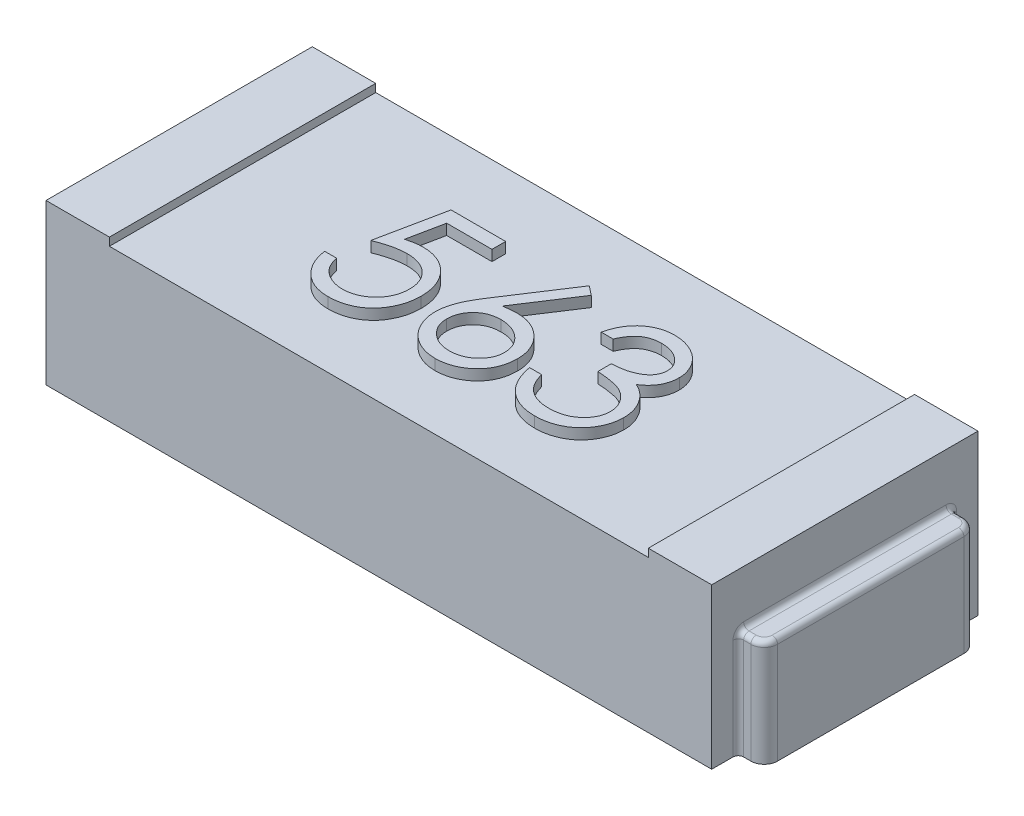
from build123d import *

# Parameters (mm, degrees)
ESQUISSE1_W             = 2.5
ESQUISSE1_H             = 1
BOSS_EXTRU_1_DEPTH      = 0.6
ESQUISSE2_W             = 2.023603034
ESQUISSE2_H             = 1
ENL_V_MAT_EXTRU_1_DEPTH = 0.03
BOSS_EXTRU_2_DEPTH      = 0.4
CONG_1_R                = 0.02
CONG_1_OF_SYM_TRIE2_R   = 0.02
BOSS_EXTRU_3_DEPTH      = 0.04


with BuildPart() as part:
    # Esquisse1 → Boss.-Extru.1 (new body)
    with BuildSketch(Plane(origin=(0, 0, 0), x_dir=(1, 0, 0), z_dir=(0, 1, 0))):
        Rectangle(ESQUISSE1_W, ESQUISSE1_H)
    extrude(amount=BOSS_EXTRU_1_DEPTH)

    # Esquisse2 → Enlèv. mat.-Extru.1 (cut)
    with BuildSketch(Plane(origin=(0, 0.6, 0), x_dir=(1, 0, 0), z_dir=(0, 1, 0))):
        Rectangle(ESQUISSE2_W, ESQUISSE2_H)
    extrude(amount=-ENL_V_MAT_EXTRU_1_DEPTH, mode=Mode.SUBTRACT)

    # Esquisse3 → Boss.-Extru.2 (add)
    with BuildSketch(Plane(origin=(0, 0, 0), x_dir=(1, 0, 0), z_dir=(0, 1, 0))):
        with BuildLine():
            Line((1.25, 0.4), (1.297141448, 0.4))
            ThreePointArc((1.297141448, 0.4), (1.332496787, 0.385355339), (1.347141448, 0.35))
            Line((1.347141448, 0.35), (1.347141448, -0.35))
            ThreePointArc((1.347141448, -0.35), (1.332496787, -0.385355339), (1.297141448, -0.4))
            Line((1.297141448, -0.4), (1.25, -0.4))
            Line((1.25, -0.4), (1.25, 0.4))
        make_face()
    boss_extru_2 = extrude(amount=BOSS_EXTRU_2_DEPTH)

    # Congé1
    cong_1_edges = [part.edges().sort_by_distance(p)[0] for p in [
        (1.25, 0.2, -0.4),
        (1.25, 0.2, 0.4),
        (1.25, 0.4, 0),
        (1.273570724, 0.4, 0.4),
        (1.332496787, 0.4, 0.385355339),
        (1.347141448, 0.4, 0),
        (1.332496787, 0.4, -0.385355339),
        (1.273570724, 0.4, -0.4),
    ]]
    fillet(cong_1_edges, radius=CONG_1_R)

    # Symétrie2: Boss.-Extru.2 across plane
    add(boss_extru_2.mirror(Plane(origin=(0, 0, 0), x_dir=(0, 0, 1), z_dir=(1, 0, 0))))

    # Congé1 of Symétrie2
    cong_1_of_sym_trie2_edges = [part.edges().sort_by_distance(p)[0] for p in [
        (-1.25, 0.2, -0.4),
        (-1.25, 0.2, 0.4),
        (-1.25, 0.4, 0),
        (-1.273570724, 0.4, 0.4),
        (-1.332496787, 0.4, 0.385355339),
        (-1.347141448, 0.4, 0),
        (-1.332496787, 0.4, -0.385355339),
        (-1.273570724, 0.4, -0.4),
    ]]
    fillet(cong_1_of_sym_trie2_edges, radius=CONG_1_OF_SYM_TRIE2_R)

    # Esquisse4 → Boss.-Extru.3 (add)
    # profile 1 of 3: a face of its own
    with BuildSketch(Plane(origin=(0, 0.57, 0), x_dir=(1, 0, 0), z_dir=(0, 1, 0))):
        with BuildLine():
            Line((0.275641026, 0.104315862), (0.230769231, 0.104315862))
            add(Edge.make_bspline(
                [(0.230769231, 0.104315862), (0.231984881, 0.109349074), (0.234361377, 0.119188592), (0.239318174, 0.133246772), (0.244718067, 0.146550132), (0.251202225, 0.158849571), (0.258274904, 0.170392272), (0.26637815, 0.180916432), (0.27513811, 0.190689713), (0.284827389, 0.199363033), (0.294988626, 0.207216994), (0.305765001, 0.213913431), (0.3169397, 0.219674024), (0.328590147, 0.224419771), (0.340751029, 0.227994846), (0.353312404, 0.230588676), (0.366307189, 0.23227312), (0.375128274, 0.232437515), (0.379607372, 0.23252099)],
                knots=[0, 0, 0, 0, 1.162005537, 2.271625781, 3.343758855, 4.383309926, 5.390229558, 6.379919256, 7.361854164, 8.333198761, 9.295911338, 10.242430842, 11.177959212, 12.116337295, 13.062827104, 14.020064771, 14.994644689, 16, 16, 16, 16], degree=3))
            add(Edge.make_bspline(
                [(0.379607372, 0.23252099), (0.386133478, 0.232323957), (0.399043337, 0.231934189), (0.418009486, 0.228374984), (0.436299032, 0.222742822), (0.453711781, 0.214960861), (0.469885843, 0.205362674), (0.484276727, 0.19393914), (0.496689371, 0.180910668), (0.507102854, 0.166520302), (0.515256425, 0.151140943), (0.521268764, 0.13531235), (0.524929004, 0.119072068), (0.52540337, 0.108106742), (0.525641026, 0.102613138)],
                knots=[0, 0, 0, 0, 1.083050992, 2.142477498, 3.193116406, 4.255571735, 5.30263384, 6.308962982, 7.297363603, 8.282367274, 9.249857812, 10.179914175, 11.08814088, 12, 12, 12, 12], degree=3))
            add(Edge.make_bspline(
                [(0.525641026, 0.102613138), (0.525474798, 0.097326453), (0.525149517, 0.086981231), (0.522387559, 0.07187816), (0.517739522, 0.057643645), (0.511300984, 0.044217765), (0.502966477, 0.031685645), (0.492870378, 0.020019089), (0.480941426, 0.009166352), (0.471901578, 0.002949285), (0.467247596, -0.000251446)],
                knots=[0, 0, 0, 0, 1.024540389, 2.004866551, 2.965041327, 3.920577974, 4.882998113, 5.874504559, 6.905732034, 8, 8, 8, 8], degree=3))
            add(Edge.make_bspline(
                [(0.467247596, -0.000251446), (0.472566418, -0.002819756), (0.483104543, -0.007908321), (0.497468904, -0.017887715), (0.510508601, -0.029410051), (0.517780561, -0.038401858), (0.521434295, -0.042919715)],
                knots=[0, 0, 0, 0, 1.015518401, 2.012035669, 3.001164323, 4, 4, 4, 4], degree=3))
            add(Edge.make_bspline(
                [(0.521434295, -0.042919715), (0.523840201, -0.046213679), (0.528612615, -0.052747668), (0.534503405, -0.063252871), (0.539847564, -0.073874513), (0.544011881, -0.084897285), (0.54723672, -0.09619343), (0.549541867, -0.107782343), (0.550973887, -0.119673489), (0.551178966, -0.127718129), (0.551282051, -0.131761862)],
                knots=[0, 0, 0, 0, 1.025084078, 2.033381695, 3.024893161, 4.013698104, 4.991890475, 5.976764909, 6.982997093, 8, 8, 8, 8], degree=3))
            add(Edge.make_bspline(
                [(0.551282051, -0.131761862), (0.551025692, -0.138763251), (0.55051418, -0.15273308), (0.54594217, -0.173372326), (0.538854564, -0.193547398), (0.528789287, -0.212843803), (0.516522501, -0.230898143), (0.501928597, -0.247051902), (0.485173396, -0.260937417), (0.466486875, -0.272538878), (0.446241571, -0.281812867), (0.424587915, -0.288249644), (0.401837907, -0.29244193), (0.386236864, -0.292891483), (0.378305288, -0.293120035)],
                knots=[0, 0, 0, 0, 0.955779014, 1.907060117, 2.875433937, 3.871313158, 4.872415639, 5.851225146, 6.836215519, 7.83643374, 8.849228613, 9.86973379, 10.916971861, 12, 12, 12, 12], degree=3))
            add(Edge.make_bspline(
                [(0.378305288, -0.293120035), (0.372959674, -0.292996005), (0.362441288, -0.292751954), (0.346977931, -0.291083583), (0.332217688, -0.288036439), (0.318140603, -0.283935967), (0.304734169, -0.278737147), (0.292039297, -0.272263047), (0.279977883, -0.264647118), (0.268663747, -0.255799463), (0.258098238, -0.245902128), (0.248562134, -0.234779413), (0.23989645, -0.222636926), (0.232333215, -0.209333633), (0.225527937, -0.195041453), (0.219930657, -0.179577382), (0.215004147, -0.163079664), (0.212713652, -0.151582844), (0.211538462, -0.145684138)],
                knots=[0, 0, 0, 0, 1.048658725, 2.063410685, 3.046034179, 4.001477787, 4.936774919, 5.862367409, 6.792675028, 7.730719943, 8.675894397, 9.627829632, 10.600096036, 11.597688215, 12.626045268, 13.701542398, 14.82072376, 16, 16, 16, 16], degree=3))
            Line((0.211538462, -0.145684138), (0.256410256, -0.145684138))
            add(Edge.make_bspline(
                [(0.256410256, -0.145684138), (0.257579298, -0.149533997), (0.259853186, -0.157022307), (0.2637238, -0.167799494), (0.268133553, -0.177679216), (0.272864204, -0.186733947), (0.277832553, -0.195052862), (0.283391828, -0.202415986), (0.289130278, -0.209146729), (0.2934559, -0.212938817), (0.295572917, -0.214794715)],
                knots=[0, 0, 0, 0, 1.198163088, 2.33053128, 3.407730985, 4.417276592, 5.372219308, 6.28897303, 7.162600585, 8, 8, 8, 8], degree=3))
            add(Edge.make_bspline(
                [(0.295572917, -0.214794715), (0.298372428, -0.216953048), (0.303962808, -0.221263053), (0.313072555, -0.226763286), (0.322653253, -0.231529146), (0.332912492, -0.235169674), (0.343628888, -0.238252197), (0.354975655, -0.240269414), (0.366852686, -0.241653439), (0.374962366, -0.241775572), (0.379106571, -0.241837984)],
                knots=[0, 0, 0, 0, 0.946170439, 1.889420265, 2.845303464, 3.807233317, 4.801018734, 5.828864929, 6.890507805, 8, 8, 8, 8], degree=3))
            add(Edge.make_bspline(
                [(0.379106571, -0.241837984), (0.383785642, -0.241749998), (0.392935163, -0.241577948), (0.406285857, -0.239995704), (0.418986921, -0.237691359), (0.430897339, -0.234132362), (0.442173126, -0.229735097), (0.452656219, -0.224213896), (0.462484234, -0.217736079), (0.471531292, -0.210373342), (0.479666365, -0.202313128), (0.486829152, -0.19388269), (0.49291839, -0.185117571), (0.497830329, -0.175969268), (0.501708979, -0.166475664), (0.504349437, -0.156610117), (0.506185367, -0.146453365), (0.506334883, -0.139549226), (0.506410256, -0.136068753)],
                knots=[0, 0, 0, 0, 1.217147791, 2.380027433, 3.494444702, 4.572153297, 5.609568379, 6.639424714, 7.649109417, 8.668170816, 9.669597737, 10.625200337, 11.543417969, 12.441394052, 13.322311151, 14.205496177, 15.095365482, 16, 16, 16, 16], degree=3))
            add(Edge.make_bspline(
                [(0.506410256, -0.136068753), (0.506191642, -0.131409991), (0.505755501, -0.122115647), (0.502425704, -0.108441707), (0.496948723, -0.095266934), (0.489281221, -0.082816107), (0.479947546, -0.071276693), (0.469038273, -0.060980767), (0.456462812, -0.052485039), (0.444888545, -0.046615231), (0.43463638, -0.042609935), (0.425862754, -0.039942083), (0.416040382, -0.037682989), (0.405288046, -0.035581236), (0.39352473, -0.033792472), (0.380763238, -0.032300784), (0.367000987, -0.031107207), (0.357473677, -0.030574193), (0.352564103, -0.030299523)],
                knots=[0, 0, 0, 0, 1.07054697, 2.135767047, 3.216561865, 4.33974944, 5.486079747, 6.621378074, 7.775625952, 8.963672916, 9.598146892, 10.304877434, 11.070270905, 11.915000392, 12.823868403, 13.805723172, 14.86925407, 16, 16, 16, 16], degree=3))
            Line((0.352564103, -0.030299523), (0.352564103, 0.020982529))
            add(Edge.make_bspline(
                [(0.352564103, 0.020982529), (0.358749983, 0.021087501), (0.370866604, 0.021293115), (0.388565791, 0.023779974), (0.40549055, 0.027220063), (0.421265798, 0.032489376), (0.435644186, 0.038609419), (0.448118415, 0.045731163), (0.458513722, 0.053647556), (0.466779589, 0.062480786), (0.47299805, 0.071954364), (0.477544736, 0.081828172), (0.480230497, 0.092188752), (0.48058902, 0.099259419), (0.480769231, 0.102813458)],
                knots=[0, 0, 0, 0, 1.321986639, 2.589447074, 3.816329219, 5.01088745, 6.139805852, 7.153945165, 8.075214402, 8.924034688, 9.728124013, 10.488707548, 11.240355623, 12, 12, 12, 12], degree=3))
            add(Edge.make_bspline(
                [(0.480769231, 0.102813458), (0.480710029, 0.105424565), (0.48059225, 0.110619237), (0.479106925, 0.118208533), (0.476874919, 0.125565811), (0.473806386, 0.132659783), (0.469699215, 0.139441251), (0.464784074, 0.14596803), (0.458931489, 0.152202855), (0.452224996, 0.158014329), (0.44502331, 0.163552792), (0.437130485, 0.16825474), (0.428784503, 0.172275463), (0.419976123, 0.175591106), (0.410676762, 0.17808529), (0.400930111, 0.179876125), (0.390717585, 0.18099579), (0.383750194, 0.181156992), (0.380208333, 0.181238939)],
                knots=[0, 0, 0, 0, 0.884392785, 1.759457502, 2.611959086, 3.489218968, 4.37281399, 5.2945488, 6.255912374, 7.266815255, 8.301784654, 9.332968512, 10.37626691, 11.440494194, 12.520033166, 13.637162961, 14.798855837, 16, 16, 16, 16], degree=3))
            add(Edge.make_bspline(
                [(0.380208333, 0.181238939), (0.374515238, 0.181040173), (0.363395298, 0.180651937), (0.347364596, 0.177251506), (0.332461834, 0.171826066), (0.321070596, 0.16534992), (0.3126588, 0.158957001), (0.306647808, 0.153373803), (0.300744878, 0.147169114), (0.295338353, 0.139960774), (0.289870642, 0.132236947), (0.284892848, 0.123604993), (0.280055749, 0.114290079), (0.277141099, 0.107704989), (0.275641026, 0.104315862)],
                knots=[0, 0, 0, 0, 1.472543308, 2.876219568, 4.221790263, 5.565193594, 6.249813518, 6.953379497, 7.687249741, 8.463570142, 9.283606569, 10.136032583, 11.040678096, 12, 12, 12, 12], degree=3))
        make_face()
    # profile 2 of 3: a face of its own
    with BuildSketch(Plane(origin=(0, 0.57, 0), x_dir=(1, 0, 0), z_dir=(0, 1, 0))):
        with BuildLine():
            Line((0.057692308, 0.23252099), (0.092247596, 0.205377561))
            Line((0.092247596, 0.205377561), (-0.039863782, 0.003354324))
            add(Edge.make_bspline(
                [(-0.039863782, 0.003354324), (-0.031068028, 0.004756304), (-0.013910916, 0.007491024), (0.003455641, 0.007942159), (0.011919071, 0.008162016)],
                knots=[0, 0, 0, 0, 1.025318673, 2, 2, 2, 2], degree=3))
            add(Edge.make_bspline(
                [(0.011919071, 0.008162016), (0.017000856, 0.008025428), (0.027004199, 0.00775656), (0.041690885, 0.005687439), (0.05580359, 0.002426708), (0.06928382, -0.002326471), (0.08217996, -0.008398236), (0.094566017, -0.015675217), (0.106209161, -0.024533172), (0.11725933, -0.034428165), (0.127291772, -0.045387735), (0.136174066, -0.057016497), (0.143635036, -0.069302337), (0.149688453, -0.082239032), (0.15438915, -0.095806641), (0.157815957, -0.109987804), (0.159841613, -0.124792299), (0.160116683, -0.13486061), (0.16025641, -0.139975003)],
                knots=[0, 0, 0, 0, 1.04369286, 2.054478336, 3.041073146, 4.015093852, 4.984733326, 5.965804835, 6.960378782, 7.985147595, 9.009457201, 10.008161701, 10.986880575, 11.956520048, 12.937015923, 13.931873656, 14.949455224, 16, 16, 16, 16], degree=3))
            add(Edge.make_bspline(
                [(0.16025641, -0.139975003), (0.16005311, -0.146972104), (0.159653062, -0.160740742), (0.155666805, -0.180794557), (0.14947257, -0.199899202), (0.140618638, -0.217749655), (0.129621154, -0.234321451), (0.11621007, -0.249005089), (0.100861, -0.262100808), (0.083505743, -0.273051754), (0.064828177, -0.281995047), (0.045206463, -0.288418653), (0.024831156, -0.292373434), (0.011001927, -0.292869235), (0.00400641, -0.293120035)],
                knots=[0, 0, 0, 0, 1.031375318, 2.029502543, 3.004789286, 3.987476834, 4.960371455, 5.9300674, 6.912260825, 7.929083631, 8.949397511, 9.960523116, 10.96833055, 12, 12, 12, 12], degree=3))
            add(Edge.make_bspline(
                [(0.00400641, -0.293120035), (-0.00272169, -0.29290172), (-0.016048878, -0.292469276), (-0.035653563, -0.288616999), (-0.054491137, -0.282373128), (-0.07242962, -0.273771088), (-0.08904685, -0.262905676), (-0.10391337, -0.24982535), (-0.116955052, -0.234809713), (-0.127808569, -0.217861092), (-0.136416959, -0.19964824), (-0.142872663, -0.180657218), (-0.146643555, -0.160957221), (-0.147170492, -0.147602772), (-0.147435897, -0.140876446)],
                knots=[0, 0, 0, 0, 1.012016664, 2.004627821, 2.994792927, 3.992885782, 4.990978636, 5.973936114, 6.964471063, 7.975201453, 8.993600317, 9.990122807, 10.98767138, 12, 12, 12, 12], degree=3))
            add(Edge.make_bspline(
                [(-0.147435897, -0.140876446), (-0.14726712, -0.13572722), (-0.146922507, -0.125213484), (-0.144516309, -0.109290051), (-0.14064991, -0.092997039), (-0.136319874, -0.079175012), (-0.131744787, -0.067851937), (-0.127937282, -0.058722867), (-0.123198139, -0.049328428), (-0.118144799, -0.03934648), (-0.112322389, -0.029034275), (-0.105991582, -0.018219465), (-0.098977346, -0.007074047), (-0.09406018, 0.000489409), (-0.091546474, 0.004355926)],
                knots=[0, 0, 0, 0, 1.173818275, 2.396712641, 3.66331629, 4.989737886, 5.693666774, 6.447286557, 7.243889047, 8.091586357, 8.998013824, 9.943181721, 10.948533338, 12, 12, 12, 12], degree=3))
            Line((-0.091546474, 0.004355926), (0.057692308, 0.23252099))
        make_face()
        with BuildLine():
            add(Edge.make_bspline(
                [(0.002504006, -0.043120035), (-0.001304886, -0.043231185), (-0.008744758, -0.043448291), (-0.019660103, -0.044709041), (-0.029990568, -0.047083194), (-0.039873016, -0.050106955), (-0.049122687, -0.054264535), (-0.057806807, -0.059314792), (-0.065958958, -0.065260675), (-0.073493751, -0.072017948), (-0.080325131, -0.079416238), (-0.08620815, -0.087340456), (-0.091282779, -0.095599628), (-0.095408753, -0.104262762), (-0.098621621, -0.113326548), (-0.100945656, -0.122749298), (-0.10223905, -0.132594199), (-0.102454225, -0.13927027), (-0.102564103, -0.14267933)],
                knots=[0, 0, 0, 0, 1.129588631, 2.206414736, 3.251139165, 4.268635594, 5.265702196, 6.250456724, 7.242448911, 8.251968645, 9.246821453, 10.222880186, 11.173611482, 12.116736599, 13.062300278, 14.020270554, 14.989073742, 16, 16, 16, 16], degree=3))
            add(Edge.make_bspline(
                [(-0.102564103, -0.14267933), (-0.102474622, -0.146057899), (-0.102299165, -0.152682769), (-0.100705976, -0.162445509), (-0.098272393, -0.171840496), (-0.094652337, -0.180819296), (-0.09033421, -0.18951877), (-0.084633449, -0.19762381), (-0.078316766, -0.205626677), (-0.070766204, -0.212912602), (-0.062662866, -0.21969212), (-0.054005551, -0.22561787), (-0.0449827, -0.230687324), (-0.035472497, -0.234660337), (-0.025609871, -0.23792095), (-0.015312649, -0.240215447), (-0.004573669, -0.241512665), (0.002700893, -0.241728121), (0.006410256, -0.241837984)],
                knots=[0, 0, 0, 0, 0.989467248, 1.94019797, 2.891935182, 3.827694429, 4.772920941, 5.730924762, 6.725747692, 7.756678648, 8.79901574, 9.819492441, 10.826891316, 11.826466727, 12.835195252, 13.867842842, 14.912794438, 16, 16, 16, 16], degree=3))
            add(Edge.make_bspline(
                [(0.006410256, -0.241837984), (0.010119613, -0.241728113), (0.017394164, -0.241512639), (0.02813323, -0.240215544), (0.038430132, -0.237920594), (0.048293919, -0.234661627), (0.057799838, -0.23068254), (0.066814798, -0.225649409), (0.07539024, -0.219655677), (0.083498897, -0.212924188), (0.091018031, -0.205585209), (0.097486214, -0.197695248), (0.10301239, -0.189453263), (0.107502988, -0.180853565), (0.111083173, -0.171835067), (0.113529097, -0.162446963), (0.115118995, -0.152682388), (0.115294905, -0.14605777), (0.115384615, -0.14267933)],
                knots=[0, 0, 0, 0, 1.087397944, 2.132534446, 3.165364764, 4.174271784, 5.174024072, 6.181601208, 7.194203697, 8.236725232, 9.267838612, 10.269026844, 11.221737037, 12.171628256, 13.107553087, 14.05945871, 15.010357665, 16, 16, 16, 16], degree=3))
            add(Edge.make_bspline(
                [(0.115384615, -0.14267933), (0.115306002, -0.139265823), (0.11515171, -0.132566218), (0.113406574, -0.122753702), (0.110986235, -0.113278672), (0.107331516, -0.104200679), (0.102583439, -0.095555547), (0.096800095, -0.087299604), (0.090109728, -0.079369554), (0.082381508, -0.072003439), (0.073968617, -0.065268142), (0.065023533, -0.059322491), (0.055665252, -0.054304637), (0.04590326, -0.050117908), (0.035625705, -0.047096555), (0.024998514, -0.04471752), (0.013885765, -0.043451518), (0.006346249, -0.043231937), (0.002504006, -0.043120035)],
                knots=[0, 0, 0, 0, 0.978206639, 1.919901502, 2.851605144, 3.780102724, 4.718870031, 5.675451981, 6.667674623, 7.690630536, 8.733308323, 9.756129687, 10.767539656, 11.776269907, 12.797430371, 13.836405707, 14.897401972, 16, 16, 16, 16], degree=3))
        make_face(mode=Mode.SUBTRACT)
    # profile 3 of 3: a face of its own
    with BuildSketch(Plane(origin=(0, 0.57, 0), x_dir=(1, 0, 0), z_dir=(0, 1, 0))):
        with BuildLine():
            Line((-0.243589744, 0.219700477), (-0.243589744, 0.168418426))
            Line((-0.243589744, 0.168418426), (-0.413661859, 0.168418426))
            Line((-0.413661859, 0.168418426), (-0.440604968, 0.036908009))
            add(Edge.make_bspline(
                [(-0.440604968, 0.036908009), (-0.435311272, 0.038369477), (-0.425055572, 0.041200839), (-0.409918449, 0.04434452), (-0.395548134, 0.046239584), (-0.386223082, 0.046498342), (-0.381710737, 0.046623554)],
                knots=[0, 0, 0, 0, 1.100273476, 2.13160584, 3.095893838, 4, 4, 4, 4], degree=3))
            add(Edge.make_bspline(
                [(-0.381710737, 0.046623554), (-0.376127346, 0.046502706), (-0.365149003, 0.046265089), (-0.349086297, 0.043983396), (-0.333753026, 0.04039198), (-0.319181259, 0.035374763), (-0.305344037, 0.028959086), (-0.292368672, 0.020944809), (-0.280060398, 0.011582905), (-0.268640028, 0.000819332), (-0.258279412, -0.011026614), (-0.249169985, -0.023763452), (-0.241432472, -0.037267404), (-0.235209507, -0.051667491), (-0.230240317, -0.066804513), (-0.226932889, -0.082837739), (-0.224730502, -0.099616042), (-0.224484447, -0.111088123), (-0.224358974, -0.116938144)],
                knots=[0, 0, 0, 0, 1.052922333, 2.070308379, 3.05430497, 4.020497103, 4.973039431, 5.925935799, 6.892292201, 7.88610001, 8.88166317, 9.857072816, 10.836096531, 11.812156883, 12.81219415, 13.836441305, 14.89672472, 16, 16, 16, 16], degree=3))
            add(Edge.make_bspline(
                [(-0.224358974, -0.116938144), (-0.224453985, -0.121012747), (-0.224642723, -0.129106888), (-0.225602521, -0.141127489), (-0.22745048, -0.152893608), (-0.229931584, -0.164406806), (-0.233151929, -0.175645288), (-0.237050365, -0.186641221), (-0.241821227, -0.197326164), (-0.24705428, -0.207801221), (-0.252946634, -0.217829579), (-0.259486421, -0.227208006), (-0.266395777, -0.236077189), (-0.27383026, -0.244342008), (-0.281858974, -0.251948153), (-0.290384684, -0.258940765), (-0.299339358, -0.265438098), (-0.308861535, -0.271176411), (-0.318739033, -0.276456834), (-0.329114492, -0.280788768), (-0.339751735, -0.2846617), (-0.35080386, -0.287748776), (-0.362245834, -0.290167712), (-0.374096516, -0.291810655), (-0.386293754, -0.293007289), (-0.394561613, -0.293082197), (-0.398737981, -0.293120035)],
                knots=[0, 0, 0, 0, 1.056347294, 2.098418968, 3.122841568, 4.141288669, 5.149314143, 6.15115421, 7.162517403, 8.180376062, 9.185164535, 10.17417709, 11.141909838, 12.097768115, 13.052685741, 14.0056014, 14.954263652, 15.917497458, 16.885230207, 17.854509472, 18.828990115, 19.81800267, 20.826176721, 21.857883937, 22.917946725, 24, 24, 24, 24], degree=3))
            add(Edge.make_bspline(
                [(-0.398737981, -0.293120035), (-0.403720007, -0.293021344), (-0.413521554, -0.292827181), (-0.427881635, -0.290795969), (-0.441698007, -0.287886838), (-0.45485945, -0.283510228), (-0.467483916, -0.278026329), (-0.479401447, -0.271095447), (-0.490916558, -0.26324129), (-0.501561135, -0.253972668), (-0.51144058, -0.243841856), (-0.520284367, -0.232847907), (-0.528160592, -0.221172273), (-0.534943127, -0.208758251), (-0.540728559, -0.19563846), (-0.545273557, -0.181763746), (-0.548941894, -0.167206603), (-0.550493811, -0.157184673), (-0.551282051, -0.152094394)],
                knots=[0, 0, 0, 0, 1.0467383, 2.05933395, 3.04377827, 4.011590433, 4.970194871, 5.932262533, 6.905835911, 7.896367577, 8.894135286, 9.877477877, 10.858688626, 11.851381753, 12.8477658, 13.868841284, 14.917554742, 16, 16, 16, 16], degree=3))
            Line((-0.551282051, -0.152094394), (-0.506410256, -0.152094394))
            add(Edge.make_bspline(
                [(-0.506410256, -0.152094394), (-0.505306177, -0.156862459), (-0.503184074, -0.166026944), (-0.49852611, -0.17890285), (-0.492830985, -0.190377025), (-0.486058935, -0.200601251), (-0.47798036, -0.209516822), (-0.46876187, -0.217462117), (-0.458426481, -0.224629992), (-0.446941734, -0.230604673), (-0.43482558, -0.235700209), (-0.42214455, -0.239093309), (-0.409243929, -0.24147915), (-0.400518447, -0.241717973), (-0.396133814, -0.241837984)],
                knots=[0, 0, 0, 0, 1.136247022, 2.183929868, 3.172523383, 4.106158343, 5.02341133, 5.958108904, 6.928429099, 7.938127109, 8.96079061, 9.975095812, 10.982467395, 12, 12, 12, 12], degree=3))
            add(Edge.make_bspline(
                [(-0.396133814, -0.241837984), (-0.391854036, -0.24172073), (-0.383427119, -0.241489856), (-0.371025492, -0.239712854), (-0.359052224, -0.236976058), (-0.347625459, -0.232880365), (-0.336545239, -0.227902548), (-0.326091843, -0.22151468), (-0.315962861, -0.214163249), (-0.306473128, -0.205740873), (-0.297781778, -0.196459488), (-0.290102332, -0.186534146), (-0.28370563, -0.175946025), (-0.278315043, -0.164878432), (-0.274221715, -0.153210067), (-0.271301574, -0.140995613), (-0.269586852, -0.128204902), (-0.269350969, -0.119480715), (-0.269230769, -0.1150351)],
                knots=[0, 0, 0, 0, 1.027316725, 2.022795036, 3.002884548, 3.971462791, 4.93288096, 5.914575861, 6.907176829, 7.935150275, 8.956128384, 9.956726525, 10.942570165, 11.921478529, 12.907843606, 13.90538589, 14.932640048, 16, 16, 16, 16], degree=3))
            add(Edge.make_bspline(
                [(-0.269230769, -0.1150351), (-0.269324838, -0.111024278), (-0.269508963, -0.103173665), (-0.271013331, -0.091688064), (-0.273630041, -0.080820487), (-0.277262024, -0.070518453), (-0.281873382, -0.060772247), (-0.28750857, -0.05157181), (-0.294273341, -0.043038405), (-0.302000753, -0.035168041), (-0.310466188, -0.027904487), (-0.319815294, -0.021712475), (-0.329852426, -0.016503344), (-0.340456655, -0.012007915), (-0.351880212, -0.008779237), (-0.363896873, -0.006355254), (-0.376636403, -0.004953059), (-0.385346501, -0.004758504), (-0.389823718, -0.004658497)],
                knots=[0, 0, 0, 0, 1.045622112, 2.046656509, 3.013763289, 3.955457236, 4.890082067, 5.820317437, 6.762574623, 7.722996705, 8.69280354, 9.665887285, 10.63943826, 11.638615906, 12.663482002, 13.728887084, 14.832589034, 16, 16, 16, 16], degree=3))
            add(Edge.make_bspline(
                [(-0.389823718, -0.004658497), (-0.393699279, -0.004741439), (-0.40170133, -0.004912692), (-0.41397602, -0.00617362), (-0.426874837, -0.008207805), (-0.440348336, -0.01100584), (-0.45443698, -0.014667423), (-0.469111038, -0.019055209), (-0.484401361, -0.024301208), (-0.494703894, -0.028262953), (-0.5, -0.030299523)],
                knots=[0, 0, 0, 0, 0.817624296, 1.688186739, 2.600797293, 3.572016777, 4.590301741, 5.671205678, 6.80286297, 8, 8, 8, 8], degree=3))
            Line((-0.5, -0.030299523), (-0.448717949, 0.219700477))
            Line((-0.448717949, 0.219700477), (-0.243589744, 0.219700477))
        make_face()
    extrude(amount=BOSS_EXTRU_3_DEPTH)


solid = part.part
